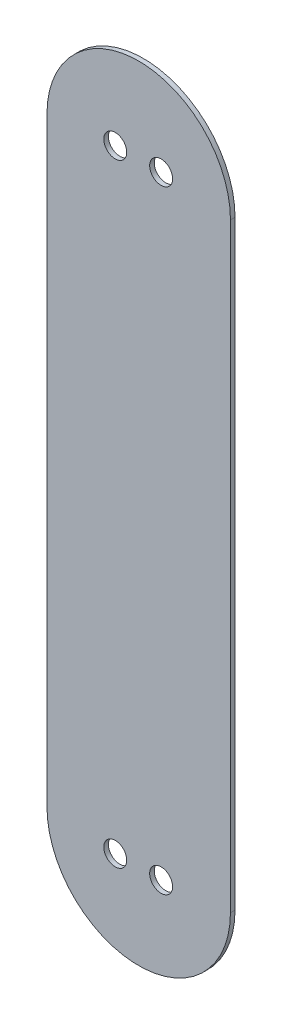
from build123d import *

# Parameters (mm, degrees)
SKETCH1_R           = 2.5
BOSS_EXTRUDE1_DEPTH = 1


with BuildPart() as part:
    # Sketch1 → Boss-Extrude1 (new body)
    with BuildSketch(Plane.XY):
        with BuildLine():
            Line((32.8, 329.894009777), (32.8, 199.1))
            ThreePointArc((32.8, 199.1), (12.8, 179.1), (-7.2, 199.1))
            Line((-7.2, 199.1), (-7.2, 329.894009777))
            ThreePointArc((-7.2, 329.894009777), (12.8, 349.894009777), (32.8, 329.894009777))
        make_face()
        with Locations((17.688362464, 331.340963798)):
            Circle(SKETCH1_R, mode=Mode.SUBTRACT)
        with Locations((7.688362464, 331.340963798)):
            Circle(SKETCH1_R, mode=Mode.SUBTRACT)
        with Locations((17.688362464, 197.7)):
            Circle(SKETCH1_R, mode=Mode.SUBTRACT)
        with Locations((7.688362464, 197.7)):
            Circle(SKETCH1_R, mode=Mode.SUBTRACT)
    extrude(amount=BOSS_EXTRUDE1_DEPTH)


solid = part.part
